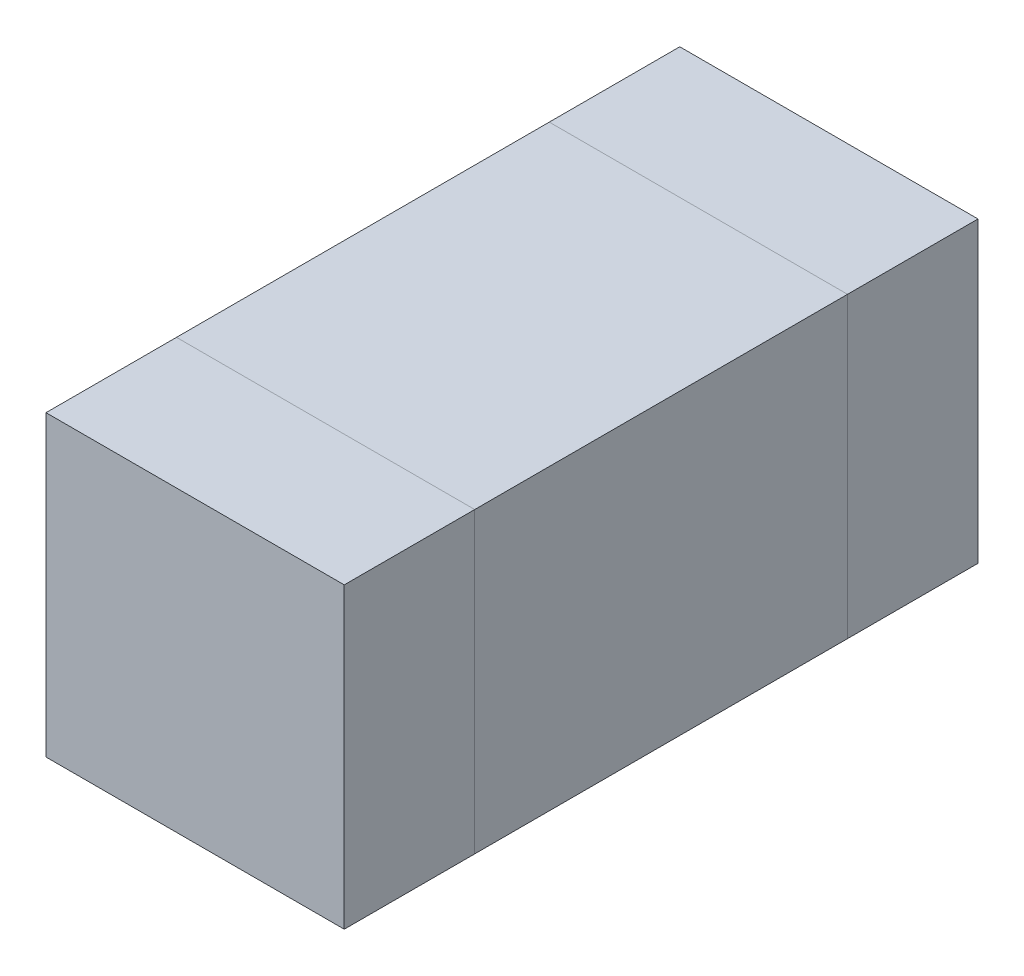
from build123d import *

# Parameters (mm, degrees)
SKETCH1_W  = 0.8
SKETCH1_H  = 1
MB_DEPTH   = 0.8
SKETCH2_W  = 0.8
SKETCH2_H  = 0.8
SB_L_DEPTH = 0.35
SKETCH3_W  = 0.8
SKETCH3_H  = 0.8
SB_R_DEPTH = 0.35


with BuildPart() as part:
    # Sketch1 → MB (new body)
    with BuildSketch(Plane(origin=(0, 0, 0), x_dir=(1, 0, 0), z_dir=(0, 1, 0))):
        Rectangle(SKETCH1_W, SKETCH1_H)
    extrude(amount=MB_DEPTH)


with BuildPart() as body_2:
    # Sketch2 → SB L (new body)
    with BuildSketch(Plane.XY.offset(0.5)):
        with Locations((0, 0.4)):
            Rectangle(SKETCH2_W, SKETCH2_H)
    extrude(amount=SB_L_DEPTH)


with BuildPart() as body_3:
    # Sketch3 → SB R (new body)
    with BuildSketch(Plane(origin=(0, 0, -0.5), x_dir=(-1, 0, 0), z_dir=(0, 0, -1))):
        with Locations((0, 0.4)):
            Rectangle(SKETCH3_W, SKETCH3_H)
    extrude(amount=SB_R_DEPTH)


solid = Compound([part.part, body_2.part, body_3.part])
